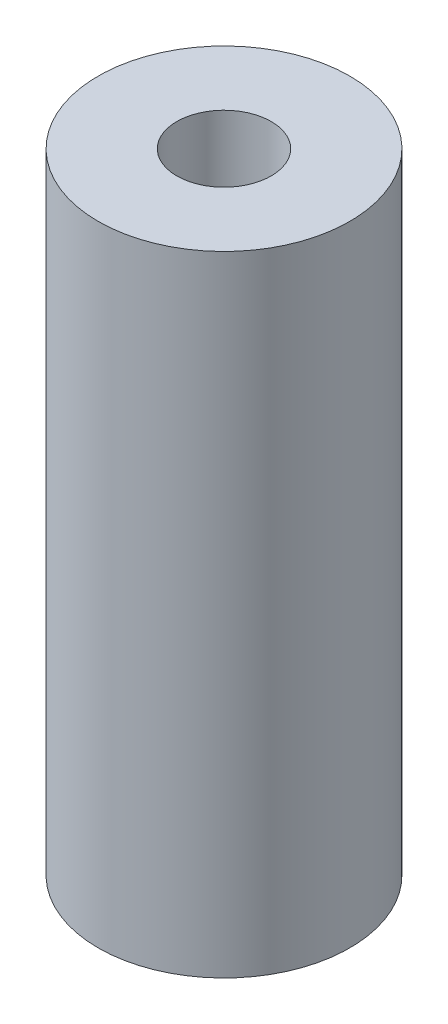
from build123d import *

# Parameters (mm, degrees)
SKETCH_1_R      = 6
SKETCH_1_R_2    = 2.25
EXTRUDE_1_DEPTH = 30


with BuildPart() as part:
    # Эскиз1 → Бобышка-Вытянуть1 (new body)
    with BuildSketch(Plane(origin=(0, 0, 0), x_dir=(1, 0, 0), z_dir=(0, 1, 0))):
        with Locations(Location((0, 0, 0), (0, 0, 270))):
            Circle(SKETCH_1_R)
        with Locations(Location((0, 0, 0), (0, 0, 270))):
            Circle(SKETCH_1_R_2, mode=Mode.SUBTRACT)
    extrude(amount=EXTRUDE_1_DEPTH)


solid = part.part
